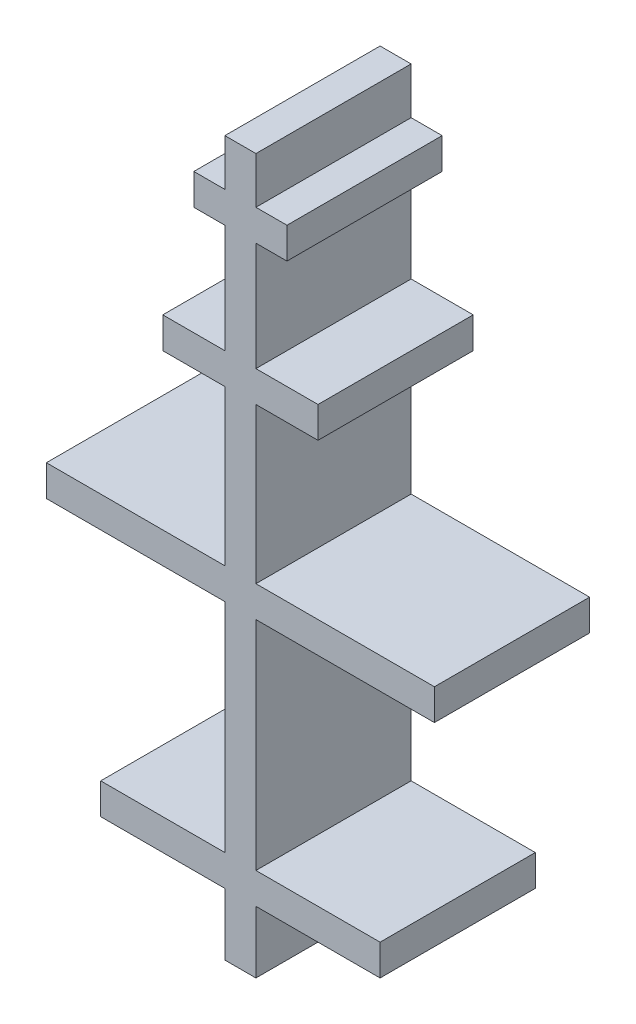
from build123d import *

# Parameters (mm, degrees)
RESSALTO_EXTRUS_O1_DEPTH = 50


with BuildPart() as part:
    # Esboço1 → Ressalto-extrusão1 (new body)
    with BuildSketch(Plane.XY):
        Polygon((10, 215), (20, 215), (20, 205), (10, 205), (10, 170), (30, 170), (30, 160), (10, 160), (10, 110), (67.5, 110), (67.5, 100), (10, 100), (10, 30), (50, 30), (50, 20), (10, 20), (10, 0), (0, 0), (0, 20), (-40, 20), (-40, 30), (0, 30), (0, 100), (-57.5, 100), (-57.5, 110), (0, 110), (0, 160), (-20, 160), (-20, 170), (0, 170), (0, 205), (-10, 205), (-10, 215), (0, 215), (0, 230), (10, 230), align=None)
    extrude(amount=RESSALTO_EXTRUS_O1_DEPTH)


solid = part.part
